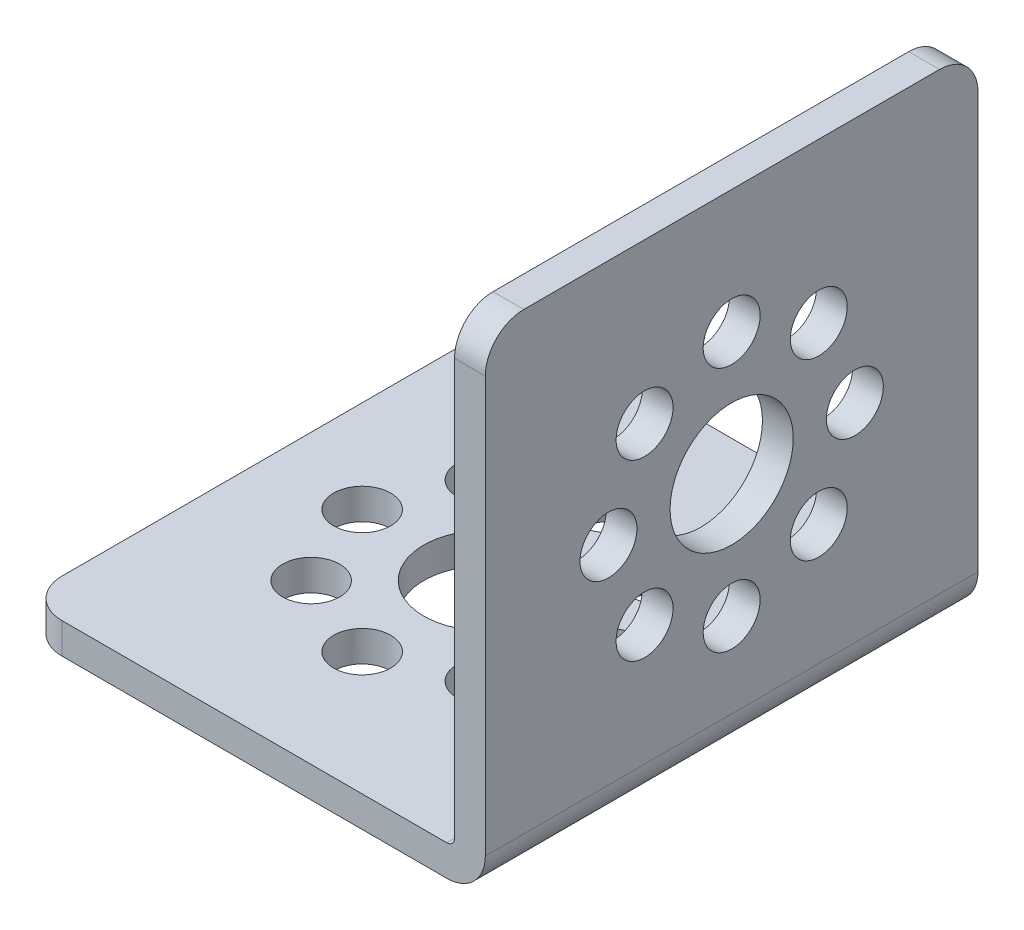
from build123d import *

# Parameters (mm, degrees)
EXTRUDE1_DEPTH     = 16
FILLET1_R          = 2.5
SKETCH2_R          = 4
CUT_EXTRUDE1_DEPTH = 40.191835885
SKETCH3_R          = 4
CUT_EXTRUDE3_DEPTH = 49
SKETCH3_3_R        = 1.85
CUT_EXTRUDE4_DEPTH = 49
SKETCH2_4_R        = 1.85
CUT_EXTRUDE2_DEPTH = 40.191835885
CIRPATTERN1_COUNT  = 8
CIRPATTERN3_COUNT  = 8
CUT_EXTRUDE5_DEPTH = 49
CUT_EXTRUDE7_DEPTH = 49
FILLET2_R          = 2.5


with BuildPart() as part:
    # Sketch1 → Extrude1 (new, symmetric)
    with BuildSketch(Plane.XY):
        with BuildLine():
            Line((-13.5, 0), (13.5, 0))
            ThreePointArc((13.5, 0), (15.267766953, 0.732233047), (16, 2.5))
            Line((16, 2.5), (16, 32))
            Line((16, 32), (14, 32))
            Line((14, 32), (14, 2.5))
            ThreePointArc((14, 2.5), (13.853553391, 2.146446609), (13.5, 2))
            Line((13.5, 2), (-13.5, 2))
            ThreePointArc((-13.5, 2), (-13.853553391, 2.146446609), (-14, 2.5))
            Line((-14, 2.5), (-14, 32))
            Line((-14, 32), (-16, 32))
            Line((-16, 32), (-16, 2.5))
            ThreePointArc((-16, 2.5), (-15.267766953, 0.732233047), (-13.5, 0))
        make_face()
    extrude(amount=EXTRUDE1_DEPTH, both=True)

    # Fillet1
    fillet1_edges = [part.edges().sort_by_distance(p)[0] for p in [
        (-15, 32, -16),
        (-15, 32, 16),
        (15, 32, -16),
        (15, 32, 16),
    ]]
    fillet(fillet1_edges, radius=FILLET1_R)

    # Sketch2 → Cut-Extrude1 (cut, through all)
    with BuildSketch(Plane.XZ):
        Circle(SKETCH2_R)
    extrude(amount=-CUT_EXTRUDE1_DEPTH, mode=Mode.SUBTRACT)

    # Sketch3 → Cut-Extrude3 (cut, through all)
    with BuildSketch(Plane.ZY.offset(16)):
        with Locations(Location((0, 16, 0), (0, 0, 270))):
            Circle(SKETCH3_R)
    extrude(amount=-CUT_EXTRUDE3_DEPTH, mode=Mode.SUBTRACT)

    # Sketch3<3> → Cut-Extrude4 (cut, through all)
    with BuildSketch(Plane.ZY.offset(16)):
        with Locations(Location((0, 8, 0), (0, 0, 270))):
            Circle(SKETCH3_3_R)
    cut_extrude4 = extrude(amount=-CUT_EXTRUDE4_DEPTH, mode=Mode.SUBTRACT)

    # Sketch2<4> → Cut-Extrude2 (cut, through all)
    with BuildSketch(Plane.XZ):
        with Locations((8, 0)):
            Circle(SKETCH2_4_R)
    cut_extrude2 = extrude(amount=-CUT_EXTRUDE2_DEPTH, mode=Mode.SUBTRACT)

    # CirPattern1: Cut-Extrude2 ×8 about axis
    cirpattern1_axis = Axis((0, 0, 0), (0, 1, 0))
    for i in range(1, CIRPATTERN1_COUNT):
        add(cut_extrude2.rotate(cirpattern1_axis, i * 360 / CIRPATTERN1_COUNT), mode=Mode.SUBTRACT)

    # CirPattern3: Cut-Extrude4 ×8 about axis
    cirpattern3_axis = Axis((0, 16, 0), (1, 0, 0))
    for i in range(1, CIRPATTERN3_COUNT):
        add(cut_extrude4.rotate(cirpattern3_axis, i * 360 / CIRPATTERN3_COUNT), mode=Mode.SUBTRACT)

    # Sketch4 → Cut-Extrude5 (cut, through all)
    with BuildSketch(Plane(origin=(0, 0, -16), x_dir=(-1, 0, 0), z_dir=(0, 0, -1))):
        with BuildLine():
            Line((14, 29.5), (14, 2.5))
            Line((14, 2.5), (14, 0.050510257))
            ThreePointArc((14, 0.050510257), (15.436491673, 0.91886117), (16, 2.5))
            Line((16, 2.5), (16, 29.5))
            Line((16, 29.5), (14, 29.5))
        make_face()
        with BuildLine():
            ThreePointArc((16, 2.5), (15.436491673, 0.91886117), (14, 0.050510257))
            Line((14, 0.050510257), (14, -1.144356578))
            Line((14, -1.144356578), (16.915765157, -1.144356578))
            Line((16.915765157, -1.144356578), (16.915765157, 33.185918655))
            Line((16.915765157, 33.185918655), (14, 33.185918655))
            Line((14, 33.185918655), (14, 29.5))
            Line((14, 29.5), (16, 29.5))
            Line((16, 29.5), (16, 2.5))
        make_face()
    extrude(amount=-CUT_EXTRUDE5_DEPTH, mode=Mode.SUBTRACT)

    # Sketch5 → Cut-Extrude7 (cut, through all)
    with BuildSketch(Plane(origin=(0, 0, -16), x_dir=(-1, 0, 0), z_dir=(0, 0, -1))):
        Polygon((13.5, 2), (15.292334009, 2), (14.396167004, 3.92414695), align=None)
    extrude(amount=-CUT_EXTRUDE7_DEPTH, mode=Mode.SUBTRACT)

    # Fillet2
    fillet2_edges = [part.edges().sort_by_distance(p)[0] for p in [
        (-14, 1.025255129, 16),
        (-14, 1.025255129, -16),
    ]]
    fillet(fillet2_edges, radius=FILLET2_R)


solid = part.part
